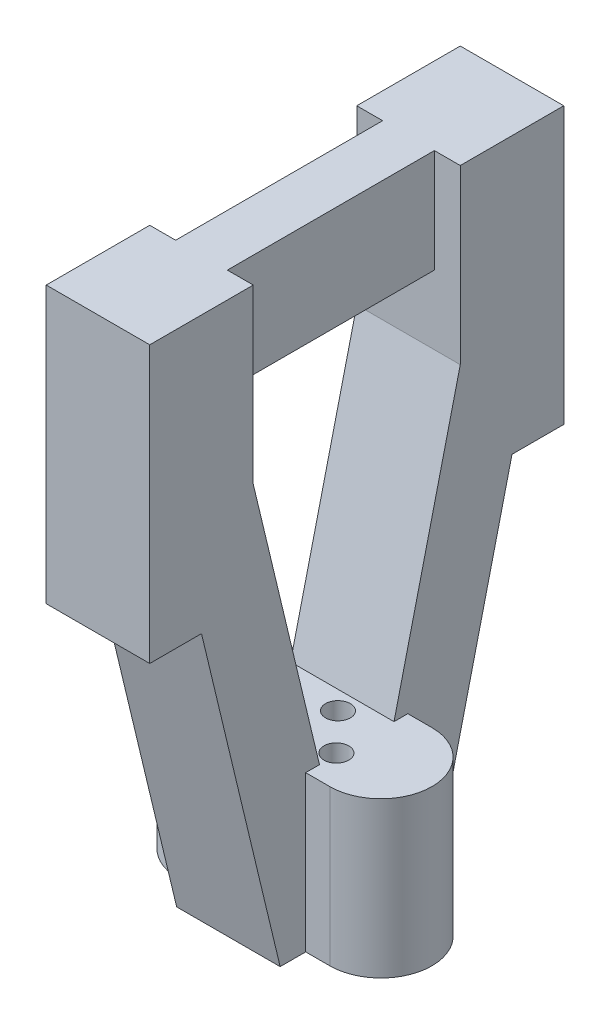
from build123d import *

# Parameters (mm, degrees)
BOSS_EXTRUDE2_DEPTH = 1.5
BOSS_EXTRUDE3_DEPTH = 4.5
SKETCH1_3_R         = 0.63
SKETCH1_3_R_2       = 0.36
CUT_EXTRUDE2_DEPTH  = 19.862460073
BOSS_EXTRUDE4_REACH = 22.02
SKETCH3_W           = 1.5
SKETCH3_H           = 3


with BuildPart() as part:
    # Sketch2 → Boss-Extrude2 (new, symmetric)
    with BuildSketch(Plane(origin=(0, 0, 0), x_dir=(0, 0, -1), z_dir=(1, 0, 0))):
        Polygon((-6, 12.5), (-6, 9.5), (-4.5, 9.5), (-2.22, 0), (0, 0), (-3, 12.5), (-3, 17.5), (-6, 17.5), align=None)
    boss_extrude2 = extrude(amount=BOSS_EXTRUDE2_DEPTH, both=True)

    # Sketch1 → Boss-Extrude3 (add)
    with BuildSketch(Plane(origin=(0, 0, 0), x_dir=(1, 0, 0), z_dir=(0, 1, 0))):
        with BuildLine():
            Line((-2.2, 1.48), (2.2, 1.48))
            ThreePointArc((2.2, 1.48), (3.68, 0), (2.2, -1.48))
            Line((2.2, -1.48), (-2.2, -1.48))
            ThreePointArc((-2.2, -1.48), (-3.68, 0), (-2.2, 1.48))
        make_face()
    extrude(amount=BOSS_EXTRUDE3_DEPTH)

    # Mirror1: Boss-Extrude2 across plane
    add(boss_extrude2.mirror(Plane.XY))

    # Sketch1<3> → Cut-Extrude2 (cut, through all)
    with BuildSketch(Plane(origin=(0, 0, 0), x_dir=(1, 0, 0), z_dir=(0, 1, 0))):
        with Locations((-2.25, 0)):
            Circle(SKETCH1_3_R)
        with Locations((0.414349108, 0.541981393)):
            Circle(SKETCH1_3_R_2)
        with Locations((1.451183077, -0.541981393)):
            Circle(SKETCH1_3_R_2)
    extrude(amount=CUT_EXTRUDE2_DEPTH, mode=Mode.SUBTRACT)

    # Sketch3 → Boss-Extrude4 (add, up to next)
    with BuildSketch(Plane.XY.offset(-3), mode=Mode.PRIVATE) as boss_extrude4_sk1:
        with Locations((0, 16)):
            Rectangle(SKETCH3_W, SKETCH3_H)
    boss_extrude4_tool1 = extrude(boss_extrude4_sk1.sketch, amount=BOSS_EXTRUDE4_REACH, mode=Mode.PRIVATE) - part.part
    add(boss_extrude4_tool1.solids().sort_by_distance((0, 16, -3))[0])


solid = part.part
